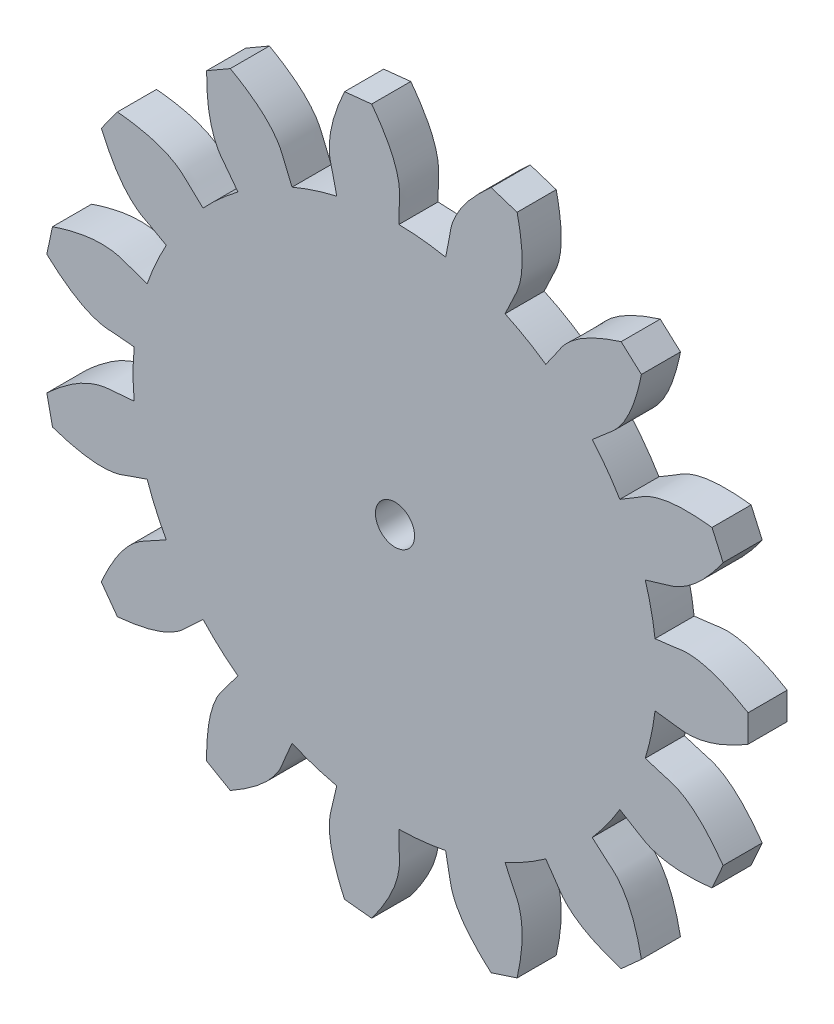
from build123d import *

# Parameters (mm, degrees)
SKETCH2_R           = 3.175
BOSS_EXTRUDE1_DEPTH = 6.35


with BuildPart() as part:
    # Sketch2 → Boss-Extrude1 (new body)
    with BuildSketch(Plane.XY):
        with BuildLine():
            Line((-55.618940229, 14.086406743), (-56.539887997, 9.753688146))
            add(Edge.make_bspline(
                [(-56.539887997, 9.753688146), (-54.202279641, 7.606515308), (-50.902869079, 4.975869405), (-46.760352408, 4.135668855), (-45.624496914, 4.120158682), (-44.028119373, 3.953048505), (-43.108144979, 3.891149546), (-42.353594767, 3.814267342)],
                knots=[0, 0, 0, 0, 0.642846062, 0.695695432, 0.824033925, 0.856068613, 1, 1, 1, 1], degree=3))
            ThreePointArc((-42.353594767, 3.814267342), (-42.525, 0), (-42.353594767, -3.814267342))
            add(Edge.make_bspline(
                [(-42.353594767, -3.814267342), (-43.108144979, -3.891149546), (-44.028119373, -3.953048505), (-45.624496914, -4.120158682), (-46.760352408, -4.135668855), (-50.902869079, -4.975869405), (-54.202279641, -7.606515308), (-56.539887997, -9.753688146)],
                knots=[0, 0, 0, 0, 0.143931387, 0.175966075, 0.304304568, 0.357153938, 1, 1, 1, 1], degree=3))
            Line((-56.539887997, -9.753688146), (-55.618940229, -14.086406743))
            add(Edge.make_bspline(
                [(-55.618940229, -14.086406743), (-52.610094862, -15.09715576), (-48.525953247, -16.1583792), (-44.399835607, -15.241027271), (-43.355871424, -14.793202469), (-41.829538141, -14.29655997), (-40.963923137, -13.978920185), (-40.243336408, -13.742252353)],
                knots=[0, 0, 0, 0, 0.642846062, 0.695695432, 0.824033925, 0.856068613, 1, 1, 1, 1], degree=3))
            ThreePointArc((-40.243336408, -13.742252353), (-38.848520586, -17.296475747), (-37.140531819, -20.711265562))
            add(Edge.make_bspline(
                [(-37.140531819, -20.711265562), (-37.798576929, -21.088404171), (-38.613838783, -21.51913898), (-40.004232402, -22.321106965), (-41.035579473, -22.797270264), (-44.47821641, -25.249744985), (-46.422397858, -28.994950776), (-47.684575481, -31.907281745)],
                knots=[0, 0, 0, 0, 0.143931387, 0.175966075, 0.304304568, 0.357153938, 1, 1, 1, 1], degree=3))
            Line((-47.684575481, -31.907281745), (-45.080972414, -35.490833935))
            add(Edge.make_bspline(
                [(-45.080972414, -35.490833935), (-41.921146733, -35.190391444), (-37.758459253, -34.498697246), (-34.362183869, -31.982411321), (-33.590621889, -31.14868452), (-32.398249754, -30.074163345), (-31.736666839, -29.431907622), (-31.174639586, -28.922611772)],
                knots=[0, 0, 0, 0, 0.642846062, 0.695695432, 0.824033925, 0.856068613, 1, 1, 1, 1], degree=3))
            ThreePointArc((-31.174639586, -28.922611772), (-28.454779035, -31.602233703), (-25.50553351, -34.02709781))
            add(Edge.make_bspline(
                [(-25.50553351, -34.02709781), (-25.953291538, -34.639282132), (-26.522874672, -35.364374831), (-27.46687268, -36.662533073), (-28.215382051, -37.517016538), (-30.362876052, -41.15771027), (-30.615661751, -45.369895844), (-30.584166664, -48.543816461)],
                knots=[0, 0, 0, 0, 0.143931387, 0.175966075, 0.304304568, 0.357153938, 1, 1, 1, 1], degree=3))
            Line((-30.584166664, -48.543816461), (-26.74809492, -50.758573515))
            add(Edge.make_bspline(
                [(-26.74809492, -50.758573515), (-23.983651493, -49.198888753), (-20.46218463, -46.873877128), (-18.382998371, -43.193745902), (-18.017248668, -42.118276041), (-17.365009656, -40.651670663), (-17.021852526, -39.79585085), (-16.715564366, -39.101988861)],
                knots=[0, 0, 0, 0, 0.642846062, 0.695695432, 0.824033925, 0.856068613, 1, 1, 1, 1], degree=3))
            ThreePointArc((-16.715564366, -39.101988861), (-13.140947686, -40.443678355), (-9.460396745, -41.459335721))
            add(Edge.make_bspline(
                [(-9.460396745, -41.459335721), (-9.620446263, -42.200713525), (-9.845864577, -43.094788998), (-10.180241144, -44.664674145), (-10.516488743, -45.749729821), (-10.997518586, -49.949133544), (-9.515199593, -53.899973749), (-8.195477582, -56.786684305)],
                knots=[0, 0, 0, 0, 0.143931387, 0.175966075, 0.304304568, 0.357153938, 1, 1, 1, 1], degree=3))
            Line((-8.195477582, -56.786684305), (-3.790228816, -57.249694608))
            add(Edge.make_bspline(
                [(-3.790228816, -57.249694608), (-1.899165025, -54.700451238), (0.372187609, -51.144137819), (0.774774551, -46.936489415), (0.671470529, -45.805235001), (0.670798367, -44.200134814), (0.636194727, -43.278729932), (0.633783789, -42.520276847)],
                knots=[0, 0, 0, 0, 0.642846062, 0.695695432, 0.824033925, 0.856068613, 1, 1, 1, 1], degree=3))
            ThreePointArc((0.633783789, -42.520276847), (4.4450729, -42.292043601), (8.220528561, -41.722877839))
            add(Edge.make_bspline(
                [(8.220528561, -41.722877839), (8.375861571, -42.465258168), (8.53358495, -43.373722643), (8.866646571, -44.943887291), (9.000801007, -46.071899195), (10.269409753, -50.103897854), (13.230527018, -53.110256526), (15.610284027, -55.210618541)],
                knots=[0, 0, 0, 0, 0.143931387, 0.175966075, 0.304304568, 0.357153938, 1, 1, 1, 1], degree=3))
            Line((15.610284027, -55.210618541), (19.823002283, -53.841823405))
            add(Edge.make_bspline(
                [(19.823002283, -53.841823405), (20.51370433, -50.743808766), (21.142205229, -46.571112451), (19.798581914, -42.563487502), (19.244086371, -41.572052703), (18.590619259, -40.10599411), (18.184238133, -39.278323435), (17.873544968, -38.58642268)],
                knots=[0, 0, 0, 0, 0.642846062, 0.695695432, 0.824033925, 0.856068613, 1, 1, 1, 1], degree=3))
            ThreePointArc((17.873544968, -38.58642268), (21.2625, -36.827730296), (24.480049798, -34.772155338))
            add(Edge.make_bspline(
                [(24.480049798, -34.772155338), (24.923906846, -35.387173889), (25.437500114, -36.152945606), (26.380410543, -37.451894022), (26.961770494, -38.427818648), (29.76066385, -41.595243046), (33.688575311, -43.137293458), (36.716885713, -44.088135259)],
                knots=[0, 0, 0, 0, 0.143931387, 0.175966075, 0.304304568, 0.357153938, 1, 1, 1, 1], degree=3))
            Line((36.716885713, -44.088135259), (40.008656202, -41.124211799))
            add(Edge.make_bspline(
                [(40.008656202, -41.124211799), (39.379567844, -38.013100766), (38.256543494, -33.945518655), (35.3990346, -30.830871924), (34.489224853, -30.150684822), (33.295953191, -29.077162674), (32.588061566, -28.486337983), (32.022807847, -27.980625486)],
                knots=[0, 0, 0, 0, 0.642846062, 0.695695432, 0.824033925, 0.856068613, 1, 1, 1, 1], degree=3))
            ThreePointArc((32.022807847, -27.980625486), (34.403447686, -24.995567854), (36.506748031, -21.809011285))
            add(Edge.make_bspline(
                [(36.506748031, -21.809011285), (37.162382201, -22.190325762), (37.943040416, -22.680995834), (39.332761873, -23.484128036), (40.260804922, -24.139219151), (44.106028801, -25.894392834), (48.321562883, -25.705500462), (51.474804297, -25.342412863)],
                knots=[0, 0, 0, 0, 0.143931387, 0.175966075, 0.304304568, 0.357153938, 1, 1, 1, 1], degree=3))
            Line((51.474804297, -25.342412863), (53.276449996, -21.29585037))
            add(Edge.make_bspline(
                [(53.276449996, -21.29585037), (51.436346326, -18.709582305), (48.755977839, -15.450436298), (44.878672613, -13.7673185), (43.770863033, -13.515989625), (42.244114331, -13.020625653), (41.357113102, -12.768805903), (40.635036331, -12.536723949)],
                knots=[0, 0, 0, 0, 0.642846062, 0.695695432, 0.824033925, 0.856068613, 1, 1, 1, 1], degree=3))
            ThreePointArc((40.635036331, -12.536723949), (41.595726721, -8.841444652), (42.221097876, -5.074891051))
            add(Edge.make_bspline(
                [(42.221097876, -5.074891051), (42.975144064, -5.156568718), (43.887884328, -5.287295832), (45.484121349, -5.455742967), (46.598380421, -5.676729365), (50.825060682, -5.716166858), (54.599313244, -3.828992908), (57.332261584, -2.214757054)],
                knots=[0, 0, 0, 0, 0.143931387, 0.175966075, 0.304304568, 0.357153938, 1, 1, 1, 1], degree=3))
            Line((57.332261584, -2.214757054), (57.332261584, 2.214757054))
            add(Edge.make_bspline(
                [(57.332261584, 2.214757054), (54.599313244, 3.828992908), (50.825060682, 5.716166858), (46.598380421, 5.676729365), (45.484121349, 5.455742967), (43.887884328, 5.287295832), (42.975144064, 5.156568718), (42.221097876, 5.074891051)],
                knots=[0, 0, 0, 0, 0.642846062, 0.695695432, 0.824033925, 0.856068613, 1, 1, 1, 1], degree=3))
            ThreePointArc((42.221097876, 5.074891051), (41.595726721, 8.841444652), (40.635036331, 12.536723949))
            add(Edge.make_bspline(
                [(40.635036331, 12.536723949), (41.357113102, 12.768805903), (42.244114331, 13.020625653), (43.770863033, 13.515989625), (44.878672613, 13.7673185), (48.755977839, 15.450436298), (51.436346326, 18.709582305), (53.276449996, 21.29585037)],
                knots=[0, 0, 0, 0, 0.143931387, 0.175966075, 0.304304568, 0.357153938, 1, 1, 1, 1], degree=3))
            Line((53.276449996, 21.29585037), (51.474804297, 25.342412863))
            add(Edge.make_bspline(
                [(51.474804297, 25.342412863), (48.321562883, 25.705500462), (44.106028801, 25.894392834), (40.260804922, 24.139219151), (39.332761873, 23.484128036), (37.943040416, 22.680995834), (37.162382201, 22.190325762), (36.506748031, 21.809011285)],
                knots=[0, 0, 0, 0, 0.642846062, 0.695695432, 0.824033925, 0.856068613, 1, 1, 1, 1], degree=3))
            ThreePointArc((36.506748031, 21.809011285), (34.403447686, 24.995567854), (32.022807847, 27.980625486))
            add(Edge.make_bspline(
                [(32.022807847, 27.980625486), (32.588061566, 28.486337983), (33.295953191, 29.077162674), (34.489224853, 30.150684822), (35.3990346, 30.830871924), (38.256543494, 33.945518655), (39.379567844, 38.013100766), (40.008656202, 41.124211799)],
                knots=[0, 0, 0, 0, 0.143931387, 0.175966075, 0.304304568, 0.357153938, 1, 1, 1, 1], degree=3))
            Line((40.008656202, 41.124211799), (36.716885713, 44.088135259))
            add(Edge.make_bspline(
                [(36.716885713, 44.088135259), (33.688575311, 43.137293458), (29.76066385, 41.595243046), (26.961770494, 38.427818648), (26.380410543, 37.451894022), (25.437500114, 36.152945606), (24.923906846, 35.387173889), (24.480049798, 34.772155338)],
                knots=[0, 0, 0, 0, 0.642846062, 0.695695432, 0.824033925, 0.856068613, 1, 1, 1, 1], degree=3))
            ThreePointArc((24.480049798, 34.772155338), (21.2625, 36.827730296), (17.873544968, 38.58642268))
            add(Edge.make_bspline(
                [(17.873544968, 38.58642268), (18.184238133, 39.278323435), (18.590619259, 40.10599411), (19.244086371, 41.572052703), (19.798581914, 42.563487502), (21.142205229, 46.571112451), (20.51370433, 50.743808766), (19.823002283, 53.841823405)],
                knots=[0, 0, 0, 0, 0.143931387, 0.175966075, 0.304304568, 0.357153938, 1, 1, 1, 1], degree=3))
            Line((19.823002283, 53.841823405), (15.610284027, 55.210618541))
            add(Edge.make_bspline(
                [(15.610284027, 55.210618541), (13.230527018, 53.110256526), (10.269409753, 50.103897854), (9.000801007, 46.071899195), (8.866646571, 44.943887291), (8.53358495, 43.373722643), (8.375861571, 42.465258168), (8.220528561, 41.722877839)],
                knots=[0, 0, 0, 0, 0.642846062, 0.695695432, 0.824033925, 0.856068613, 1, 1, 1, 1], degree=3))
            ThreePointArc((8.220528561, 41.722877839), (4.4450729, 42.292043601), (0.633783789, 42.520276847))
            add(Edge.make_bspline(
                [(0.633783789, 42.520276847), (0.636194727, 43.278729932), (0.670798367, 44.200134814), (0.671470529, 45.805235001), (0.774774551, 46.936489415), (0.372187609, 51.144137819), (-1.899165025, 54.700451238), (-3.790228816, 57.249694608)],
                knots=[0, 0, 0, 0, 0.143931387, 0.175966075, 0.304304568, 0.357153938, 1, 1, 1, 1], degree=3))
            Line((-3.790228816, 57.249694608), (-8.195477582, 56.786684305))
            add(Edge.make_bspline(
                [(-8.195477582, 56.786684305), (-9.515199593, 53.899973749), (-10.997518586, 49.949133544), (-10.516488743, 45.749729821), (-10.180241144, 44.664674145), (-9.845864577, 43.094788998), (-9.620446263, 42.200713525), (-9.460396745, 41.459335721)],
                knots=[0, 0, 0, 0, 0.642846062, 0.695695432, 0.824033925, 0.856068613, 1, 1, 1, 1], degree=3))
            ThreePointArc((-9.460396745, 41.459335721), (-13.140947686, 40.443678355), (-16.715564366, 39.101988861))
            add(Edge.make_bspline(
                [(-16.715564366, 39.101988861), (-17.021852526, 39.79585085), (-17.365009656, 40.651670663), (-18.017248668, 42.118276041), (-18.382998371, 43.193745902), (-20.46218463, 46.873877128), (-23.983651493, 49.198888753), (-26.74809492, 50.758573515)],
                knots=[0, 0, 0, 0, 0.143931387, 0.175966075, 0.304304568, 0.357153938, 1, 1, 1, 1], degree=3))
            Line((-26.74809492, 50.758573515), (-30.584166664, 48.543816461))
            add(Edge.make_bspline(
                [(-30.584166664, 48.543816461), (-30.615661751, 45.369895844), (-30.362876052, 41.15771027), (-28.215382051, 37.517016538), (-27.46687268, 36.662533073), (-26.522874672, 35.364374831), (-25.953291538, 34.639282132), (-25.50553351, 34.02709781)],
                knots=[0, 0, 0, 0, 0.642846062, 0.695695432, 0.824033925, 0.856068613, 1, 1, 1, 1], degree=3))
            ThreePointArc((-25.50553351, 34.02709781), (-28.454779035, 31.602233703), (-31.174639586, 28.922611772))
            add(Edge.make_bspline(
                [(-31.174639586, 28.922611772), (-31.736666839, 29.431907622), (-32.398249754, 30.074163345), (-33.590621889, 31.14868452), (-34.362183869, 31.982411321), (-37.758459253, 34.498697246), (-41.921146733, 35.190391444), (-45.080972414, 35.490833935)],
                knots=[0, 0, 0, 0, 0.143931387, 0.175966075, 0.304304568, 0.357153938, 1, 1, 1, 1], degree=3))
            Line((-45.080972414, 35.490833935), (-47.684575481, 31.907281745))
            add(Edge.make_bspline(
                [(-47.684575481, 31.907281745), (-46.422397858, 28.994950776), (-44.47821641, 25.249744985), (-41.035579473, 22.797270264), (-40.004232402, 22.321106965), (-38.613838783, 21.51913898), (-37.798576929, 21.088404171), (-37.140531819, 20.711265562)],
                knots=[0, 0, 0, 0, 0.642846062, 0.695695432, 0.824033925, 0.856068613, 1, 1, 1, 1], degree=3))
            ThreePointArc((-37.140531819, 20.711265562), (-38.848520586, 17.296475747), (-40.243336408, 13.742252353))
            add(Edge.make_bspline(
                [(-40.243336408, 13.742252353), (-40.963923137, 13.978920185), (-41.829538141, 14.29655997), (-43.355871424, 14.793202469), (-44.399835607, 15.241027271), (-48.525953247, 16.1583792), (-52.610094862, 15.09715576), (-55.618940229, 14.086406743)],
                knots=[0, 0, 0, 0, 0.143931387, 0.175966075, 0.304304568, 0.357153938, 1, 1, 1, 1], degree=3))
        make_face()
        Circle(SKETCH2_R, mode=Mode.SUBTRACT)
    extrude(amount=BOSS_EXTRUDE1_DEPTH)


solid = part.part
